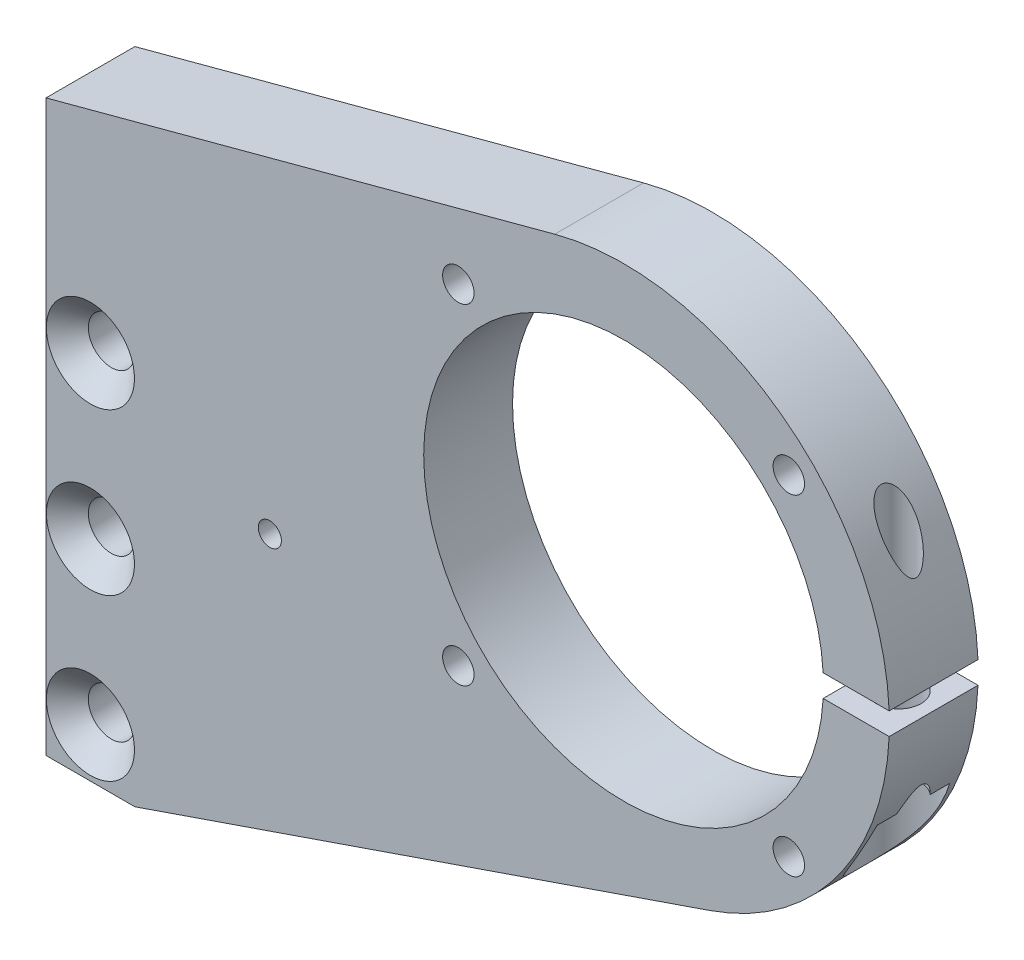
from build123d import *

# Parameters (mm, degrees)
BOSS_EXTRUDE1_DEPTH           = 12.7
CUT_EXTRUDE1_DEPTH            = 270.19769127
SKETCH3_W                     = 28.575
SKETCH3_H                     = 12.7
F_8_CLEARANCE_HOLE1_D         = 4.5
F_1_4_CLEARANCE_HOLE1_D       = 6.6
F_12_CLEARANCE_HOLE1_D        = 6
HOLE1_D                       = 6.4
HOLE1_DEPTH                   = 24.77643101
HOLE1_CBORE_D                 = 11.2
HOLE1_CBORE_DEPTH             = 11.77643101
F_10_CLEARANCE_HOLE1_D        = 5
F_10_CLEARANCE_HOLE1_DEPTH    = 36.4125
SKETCH14_R                    = 3
SKETCH14_R_2                  = 1.651
BOSS_EXTRUDE2_DEPTH           = 12.7
SKETCH_1_R                    = 6.3
CUT_EXTRUDE_1_DEPTH           = 3
CUT_EXTRUDE_1_DRAFT           = -45
CUT_EXTRUDE_1_PROFILE_2_DEPTH = 3
CUT_EXTRUDE_1_PROFILE_2_DRAFT = -45
CUT_EXTRUDE_1_PROFILE_3_DEPTH = 3
CUT_EXTRUDE_1_PROFILE_3_DRAFT = -45


with BuildPart() as part:
    # Sketch1 → Boss-Extrude1 (new body)
    with BuildSketch(Plane(origin=(0, 0, 0), x_dir=(-1, 0, 0), z_dir=(0, 0, -1))):
        with BuildLine():
            Line((224.169455465, 127.72254562), (151.435240745, 147.211619716))
            ThreePointArc((151.435240745, 147.211619716), (105.257753851, 121.607458019), (129.246532787, 74.570537656))
            Line((129.246532787, 74.570537656), (211.469455465, 46.304993078))
            Line((211.469455465, 46.304993078), (224.169455465, 46.304993078))
            Line((224.169455465, 46.304993078), (224.169455465, 127.72254562))
        make_face()
    extrude(amount=-BOSS_EXTRUDE1_DEPTH)

    # Sketch2 → Cut-Extrude1 (cut, through all)
    with BuildSketch(Plane.XY.offset(12.7)):
        with BuildLine():
            Line((-103.633291463, 112.093938317), (-113.179018515, 112.093938317))
            ThreePointArc((-113.179018515, 112.093938317), (-113.134717032, 110.506438317), (-113.179018515, 108.918938317))
            Line((-113.179018515, 108.918938317), (-103.633291463, 108.918938317))
            ThreePointArc((-103.633291463, 108.918938317), (-103.600117032, 110.506438317), (-103.633291463, 112.093938317))
        make_face()
    extrude(amount=-CUT_EXTRUDE1_DEPTH, mode=Mode.SUBTRACT)

    # Sketch3 → Cut-Revolve1 (revolve, cut)
    with BuildSketch(Plane(origin=(0, 110.506438317, 0), x_dir=(1, 0, 0), z_dir=(0, 1, 0))):
        with Locations((-127.312617032, -6.35)):
            Rectangle(SKETCH3_W, SKETCH3_H)
    revolve(axis=Axis((-141.600117032, 110.506438317, 0), (0, 0, 1)), mode=Mode.SUBTRACT)

    # #8 Clearance Hole1 (through all)
    with Locations(Plane.XY.offset(12.7)):
        with Locations((-117.978117032, 86.884438317), (-165.222117032, 86.884438317), (-165.222117032, 134.128438317), (-117.978117032, 134.128438317)):
            Hole(F_8_CLEARANCE_HOLE1_D / 2)

    # 1/4 Clearance Hole1 (through all)
    with Locations(Plane(origin=(0, 0, 0), x_dir=(-1, 0, 0), z_dir=(0, 0, -1))):
        with Locations((217.819455465, 53.304993078), (217.819455465, 76.304993078), (217.819455465, 99.304993078)):
            Hole(F_1_4_CLEARANCE_HOLE1_D / 2)

    # #12 Clearance Hole1 (through all)
    with Locations(Plane.XY.offset(12.7)):
        with Locations((-192.169455465, 89.72254562)):
            Hole(F_12_CLEARANCE_HOLE1_D / 2)

    # Hole1
    with Locations(Plane(origin=(0, 84.142507307, 0), x_dir=(-1, 0, 0), z_dir=(0, -1, 0))):
        with Locations((108.633291463, -6.35)):
            CounterBoreHole(HOLE1_D / 2, HOLE1_CBORE_D / 2, HOLE1_CBORE_DEPTH, depth=HOLE1_DEPTH)

    # #10 Clearance Hole1
    with Locations(Plane(origin=(0, 112.093938317, 0), x_dir=(-1, 0, 0), z_dir=(0, -1, 0))):
        with Locations((108.633291463, -6.35)):
            Hole(F_10_CLEARANCE_HOLE1_D / 2, depth=F_10_CLEARANCE_HOLE1_DEPTH)

    # Sketch14 → Boss-Extrude2 (add)
    with BuildSketch(Plane(origin=(0, 0, 0), x_dir=(-1, 0, 0), z_dir=(0, 0, -1))):
        with Locations((192.169455465, 89.72254562)):
            Circle(SKETCH14_R)
        with Locations((192.169455465, 89.72254562)):
            Circle(SKETCH14_R_2, mode=Mode.SUBTRACT)
    extrude(amount=-BOSS_EXTRUDE2_DEPTH)


with BuildPart() as cut_extrude_1_tool:
    # 草图1 → 切除-拉伸1 (with draft: the straight prism first)
    with BuildSketch(Plane.XY.offset(12.7)):
        with Locations((-217.819455465, 99.304993078)):
            Circle(SKETCH_1_R)
    extrude(amount=-CUT_EXTRUDE_1_DEPTH)
    # 切除-拉伸1: the draft: its side faces are tilted about the plane it starts from
    cut_extrude_1_sides = [cut_extrude_1_tool.faces().sort_by_distance(p)[0] for p in [
        (-224.119455465, 99.304993078, 11.2),
    ]]
    draft(cut_extrude_1_sides, Plane.XY.offset(12.7), CUT_EXTRUDE_1_DRAFT)


with BuildPart() as part_1:
    add(part.part)

    # 切除-拉伸1: cut by cut_extrude_1_tool
    add(cut_extrude_1_tool.part, mode=Mode.SUBTRACT)


with BuildPart() as cut_extrude_1_profile_2_tool:
    # 草图1 → 切除-拉伸1 profile 2 (with draft: the straight prism first)
    with BuildSketch(Plane.XY.offset(12.7)):
        with Locations((-217.819455465, 76.304993078)):
            Circle(SKETCH_1_R)
    extrude(amount=-CUT_EXTRUDE_1_PROFILE_2_DEPTH)
    # 切除-拉伸1 profile 2: the draft: its side faces are tilted about the plane it starts from
    cut_extrude_1_profile_2_sides = [cut_extrude_1_profile_2_tool.faces().sort_by_distance(p)[0] for p in [
        (-224.119455465, 76.304993078, 11.2),
    ]]
    draft(cut_extrude_1_profile_2_sides, Plane.XY.offset(12.7), CUT_EXTRUDE_1_PROFILE_2_DRAFT)


with BuildPart() as part_2:
    add(part_1.part)

    # 切除-拉伸1 profile 2: cut by cut_extrude_1_profile_2_tool
    add(cut_extrude_1_profile_2_tool.part, mode=Mode.SUBTRACT)


with BuildPart() as cut_extrude_1_profile_3_tool:
    # 草图1 → 切除-拉伸1 profile 3 (with draft: the straight prism first)
    with BuildSketch(Plane.XY.offset(12.7)):
        with Locations((-217.819455465, 53.304993078)):
            Circle(SKETCH_1_R)
    extrude(amount=-CUT_EXTRUDE_1_PROFILE_3_DEPTH)
    # 切除-拉伸1 profile 3: the draft: its side faces are tilted about the plane it starts from
    cut_extrude_1_profile_3_sides = [cut_extrude_1_profile_3_tool.faces().sort_by_distance(p)[0] for p in [
        (-224.119455465, 53.304993078, 11.2),
    ]]
    draft(cut_extrude_1_profile_3_sides, Plane.XY.offset(12.7), CUT_EXTRUDE_1_PROFILE_3_DRAFT)


with BuildPart() as part_3:
    add(part_2.part)

    # 切除-拉伸1 profile 3: cut by cut_extrude_1_profile_3_tool
    add(cut_extrude_1_profile_3_tool.part, mode=Mode.SUBTRACT)


solid = part_3.part
